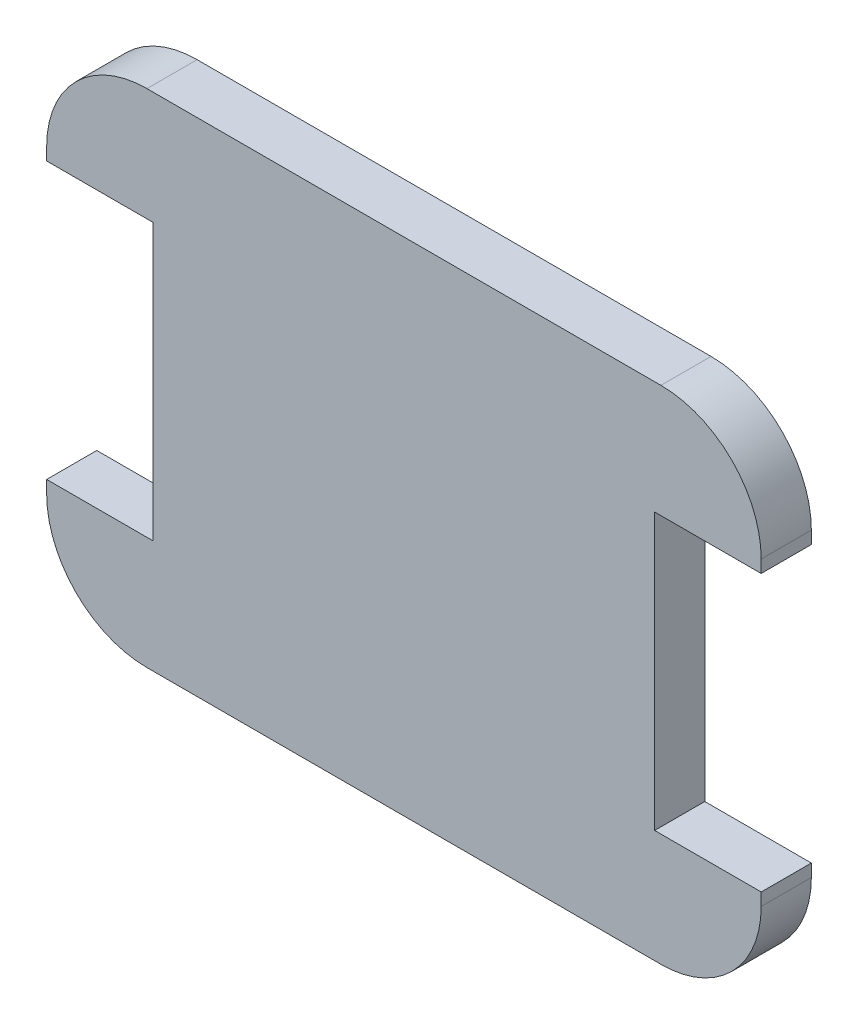
from build123d import *

# Parameters (mm, degrees)
CROQUIS1_W              = 10
CROQUIS1_H              = 10
SALIENTE_EXTRUIR1_DEPTH = 1
SALIENTE_EXTRUIR2_DEPTH = 1


with BuildPart() as part:
    # Croquis1 → Saliente-Extruir1 (new body)
    with BuildSketch(Plane.XY):
        Rectangle(CROQUIS1_W, CROQUIS1_H)
    extrude(amount=SALIENTE_EXTRUIR1_DEPTH)

    # Croquis2 → Saliente-Extruir2 (add, through all)
    with BuildSketch(Plane.XY.offset(1)):
        with BuildLine():
            Line((-5, 5), (-5.125, 5))
            ThreePointArc((-5.125, 5), (-6.539213562, 4.414213562), (-7.125, 3))
            Line((-7.125, 3), (-7.125, 2.75))
            Line((-7.125, 2.75), (-5, 2.75))
            Line((-5, 2.75), (-5, 5))
        make_face()
        with BuildLine():
            Line((5, 2.75), (7.125, 2.75))
            Line((7.125, 2.75), (7.125, 3))
            ThreePointArc((7.125, 3), (6.539213562, 4.414213562), (5.125, 5))
            Line((5.125, 5), (5, 5))
            Line((5, 5), (5, 2.75))
        make_face()
        with BuildLine():
            Line((5, -5), (5.125, -5))
            ThreePointArc((5.125, -5), (6.539213562, -4.414213562), (7.125, -3))
            Line((7.125, -3), (7.125, -2.75))
            Line((7.125, -2.75), (5, -2.75))
            Line((5, -2.75), (5, -5))
        make_face()
        with BuildLine():
            Line((-5, -2.75), (-7.125, -2.75))
            Line((-7.125, -2.75), (-7.125, -3))
            ThreePointArc((-7.125, -3), (-6.539213562, -4.414213562), (-5.125, -5))
            Line((-5.125, -5), (-5, -5))
            Line((-5, -5), (-5, -2.75))
        make_face()
    extrude(amount=-SALIENTE_EXTRUIR2_DEPTH)


solid = part.part
